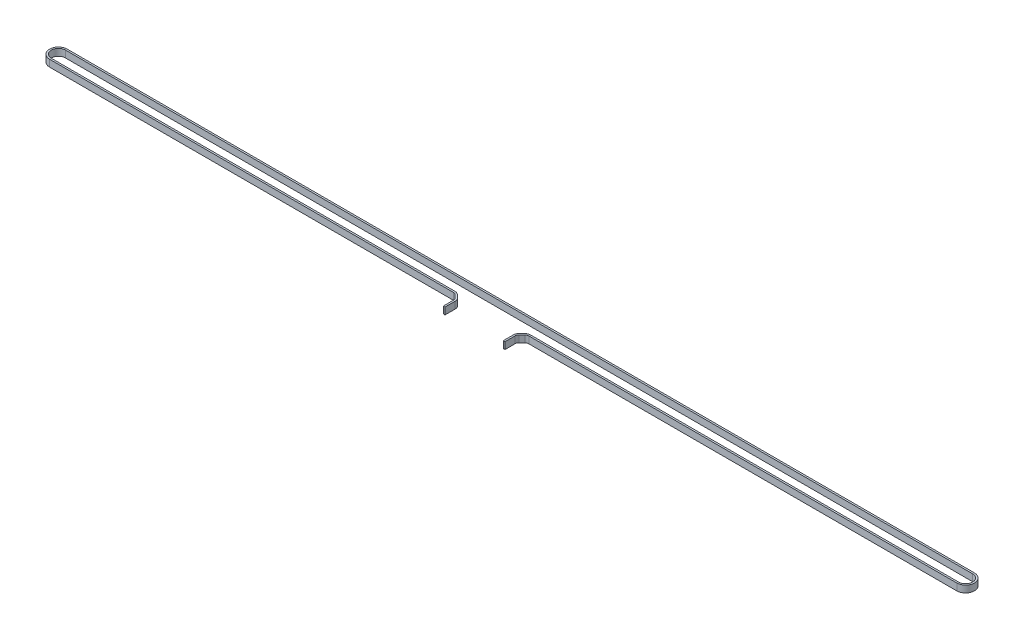
from build123d import *

# Parameters (mm, degrees)
BOSS_EXTRUDE1_DEPTH = 3
BOSS_EXTRUDE2_DEPTH = 3
CUT_EXTRUDE1_DEPTH  = 406.369387103
FILLET1_R           = 5
FILLET2_R           = 3.5


with BuildPart() as part:
    # Sketch1 → Boss-Extrude1 (new, symmetric)
    with BuildSketch(Plane(origin=(0, 0, 0), x_dir=(1, 0, 0), z_dir=(0, 1, 0))):
        with BuildLine():
            Line((397, -7.7), (-397, -7.7))
            ThreePointArc((-397, -7.7), (-404.7, 0), (-397, 7.7))
            Line((-397, 7.7), (397, 7.7))
            ThreePointArc((397, 7.7), (404.7, 0), (397, -7.7))
        make_face()
        with BuildLine():
            Line((397, -6.2), (-397, -6.2))
            ThreePointArc((-397, -6.2), (-403.2, 0), (-397, 6.2))
            Line((-397, 6.2), (397, 6.2))
            ThreePointArc((397, 6.2), (403.2, 0), (397, -6.2))
        make_face(mode=Mode.SUBTRACT)
    extrude(amount=BOSS_EXTRUDE1_DEPTH, both=True)

    # Sketch2 → Boss-Extrude2 (add, symmetric)
    with BuildSketch(Plane(origin=(0, 0, 0), x_dir=(1, 0, 0), z_dir=(0, 1, 0))):
        Polygon((-36.145786863, -11.5), (-36.145786863, -14.5), (-36.145786863, -22.5), (-37.645786863, -22.5), (-37.645786863, -12.137653431), (-43.807502688, -6.2), (-41.645786863, -6.2), align=None)
        Polygon((14.854213137, -14.5), (14.854213137, -11.5), (20.354213137, -6.2), (22.515928962, -6.2), (16.354213137, -12.137653431), (16.354213137, -22.5), (14.854213137, -22.5), align=None)
    extrude(amount=BOSS_EXTRUDE2_DEPTH, both=True)

    # Sketch3 → Cut-Extrude1 (cut, through all)
    with BuildSketch(Plane(origin=(0, 3, 0), x_dir=(1, 0, 0), z_dir=(0, 1, 0))):
        Polygon((-40.089183089, -7.7), (-41.645786863, -6.2), (20.354213137, -6.2), (18.797609364, -7.7), align=None)
    extrude(amount=-CUT_EXTRUDE1_DEPTH, mode=Mode.SUBTRACT)

    # Fillet1
    fillet1_edges = [part.edges().sort_by_distance(p)[0] for p in [
        (-36.145786863, 0, 11.5),
        (14.854213137, 0, 11.5),
        (-41.645786863, 0, 6.2),
        (20.354213137, 0, 6.2),
    ]]
    fillet(fillet1_edges, radius=FILLET1_R)

    # Fillet2
    fillet2_edges = [part.edges().sort_by_distance(p)[0] for p in [
        (-42.250898914, 0, 7.7),
        (-37.645786863, 0, 12.137653431),
        (20.959325189, 0, 7.7),
        (16.354213137, 0, 12.137653431),
    ]]
    fillet(fillet2_edges, radius=FILLET2_R)


solid = part.part
